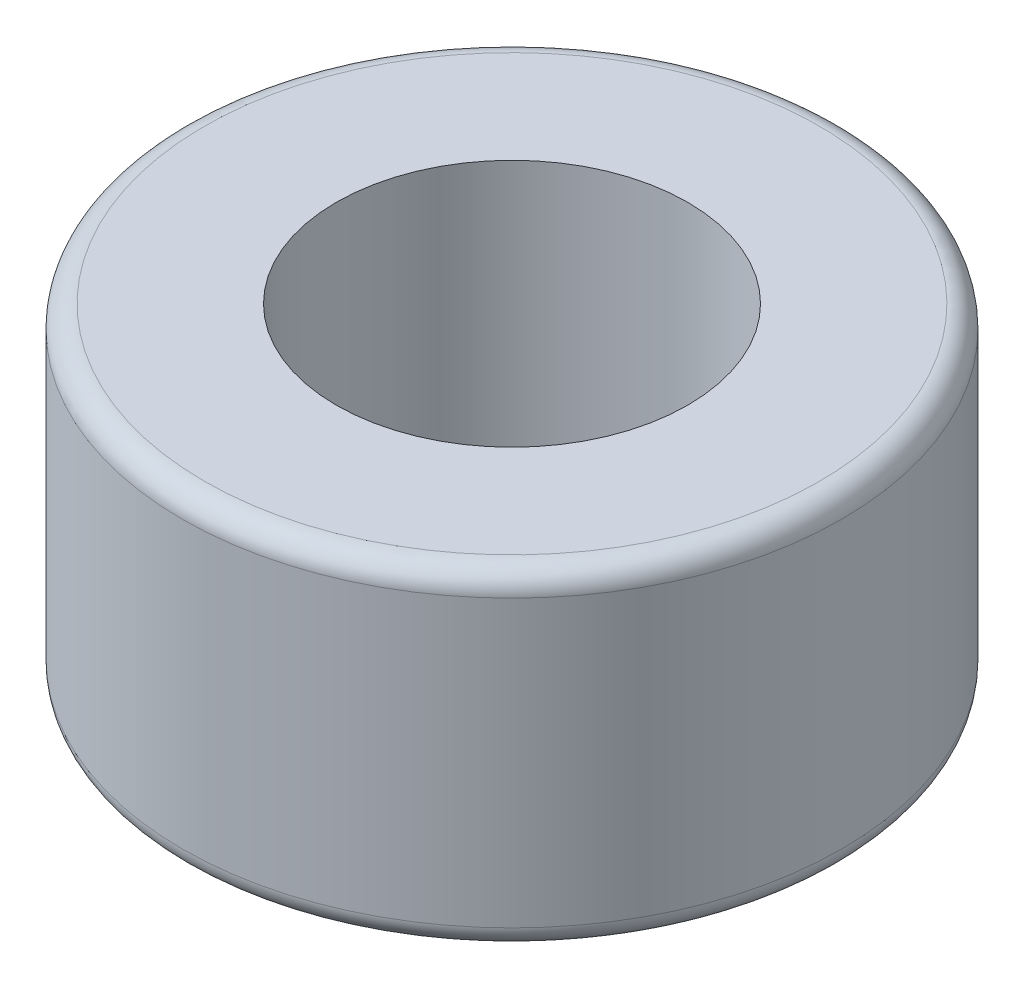
from build123d import *

# Parameters (mm, degrees)
SKETCH1_R           = 3
BOSS_EXTRUDE1_DEPTH = 3
SKETCH2_R           = 1.6
CUT_EXTRUDE1_DEPTH  = 3
FILLET1_R           = 0.2


with BuildPart() as part:
    # Sketch1 → Boss-Extrude1 (new body)
    with BuildSketch(Plane(origin=(0, 0, 0), x_dir=(1, 0, 0), z_dir=(0, 1, 0))):
        with Locations(Location((0, 0, 0), (0, 0, 270))):
            Circle(SKETCH1_R)
    extrude(amount=BOSS_EXTRUDE1_DEPTH)

    # Sketch2 → Cut-Extrude1 (cut)
    with BuildSketch(Plane(origin=(0, 3, 0), x_dir=(1, 0, 0), z_dir=(0, 1, 0))):
        with Locations(Location((0, 0, 0), (0, 0, 270))):
            Circle(SKETCH2_R)
    extrude(amount=-CUT_EXTRUDE1_DEPTH, mode=Mode.SUBTRACT)

    # Fillet1
    fillet1_edges = [part.edges().sort_by_distance(p)[0] for p in [
        (0, 0, -3),
        (0, 3, -3),
    ]]
    fillet(fillet1_edges, radius=FILLET1_R)


solid = part.part
